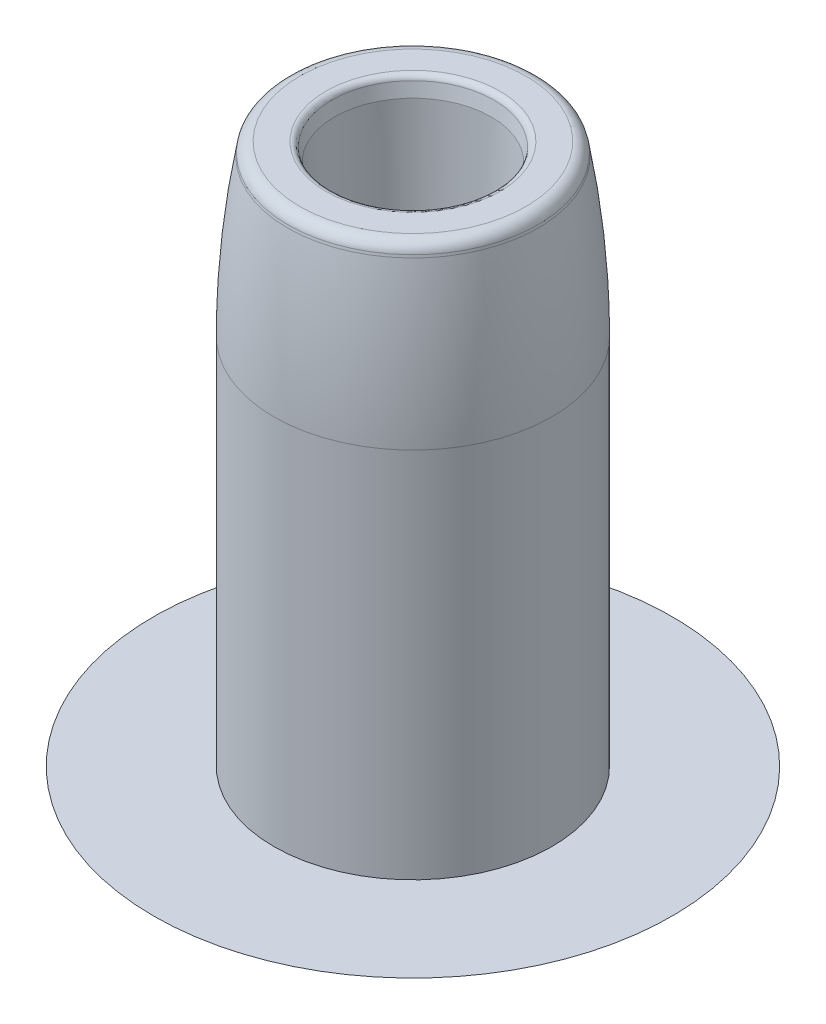
from build123d import *

# Parameters (mm, degrees)
CHAMFER1_SIZE      = 3.81
CHAMFER1_SIZE2     = 0.671805796
FILLET2_R          = 0.508
FILLET3_R          = 38.1
CHAMFER2_SIZE      = 0.762
CHAMFER2_SIZE2     = 0.135060614
FILLET4_R          = 0.254
SKETCH6_R          = 2.950428165
CUT_EXTRUDE1_DEPTH = 28.612445783
FILLET5_R          = 2.54


with BuildPart() as part:
    # Sketch3 → Revolve1 (revolve)
    with BuildSketch(Plane(origin=(0, 0, 0), x_dir=(0, 0, -1), z_dir=(1, 0, 0))):
        with BuildLine():
            Line((-3.331428165, 0.1905), (-2.950428165, -13.7795))
            Line((-2.950428165, -13.7795), (-2.950428165, -22.6695))
            Line((-2.950428165, -22.6695), (0, -22.6695))
            Line((0, -22.6695), (0, -24.1935))
            add(Edge.make_bspline(
                [(-10.951428165, -22.6695), (-7.67361224, -23.87858079), (-8.424695912, -25.057739032), (-3.760861411, -24.039674634), (-1.096246091, -24.1935), (0, -24.1935)],
                knots=[0, 0, 0, 0, 0.345230168, 0.440287605, 1, 1, 1, 1], degree=3))
            Line((-10.951428165, -22.6695), (-5.871428165, -22.6695))
            Line((-5.871428165, -22.6695), (-5.871428165, 0.1905))
            Line((-5.871428165, 0.1905), (-3.331428165, 0.1905))
        make_face()
    revolve(axis=Axis((0, -22.6695, 0), (0, -1, 0)))

    # Chamfer1
    chamfer1_edges = [part.edges().sort_by_distance(p)[0] for p in [
        (0, 0.1905, -5.871428165),
    ]]
    chamfer1_side = [part.faces().sort_by_distance(p)[0] for p in [
        (0, -11.2395, -5.871428165),
    ]]
    chamfer(chamfer1_edges, length=CHAMFER1_SIZE, length2=CHAMFER1_SIZE2, reference=chamfer1_side[0])

    # Fillet2
    fillet2_edges = [part.edges().sort_by_distance(p)[0] for p in [
        (0, 0.1905, -5.199622369),
    ]]
    fillet(fillet2_edges, radius=FILLET2_R)

    # Fillet3
    fillet3_edges = [part.edges().sort_by_distance(p)[0] for p in [
        (0, -3.6195, -5.871428165),
    ]]
    fillet(fillet3_edges, radius=FILLET3_R)

    # Chamfer2
    chamfer2_edges = [part.edges().sort_by_distance(p)[0] for p in [
        (0, 0.1905, -3.331428165),
    ]]
    chamfer2_side = [part.faces().sort_by_distance(p)[0] for p in [
        (0, -6.7945, -3.140928165),
    ]]
    chamfer(chamfer2_edges, length=CHAMFER2_SIZE, length2=CHAMFER2_SIZE2, reference=chamfer2_side[0])

    # Fillet4
    fillet4_edges = [part.edges().sort_by_distance(p)[0] for p in [
        (0, 0.1905, -3.46648878),
    ]]
    fillet(fillet4_edges, radius=FILLET4_R)

    # Sketch6 → Cut-Extrude1 (cut, through all)
    with BuildSketch(Plane(origin=(0, -22.6695, 0), x_dir=(1, 0, 0), z_dir=(0, 1, 0))):
        with Locations(Location((0, 0, 0), (0, 0, 270))):
            Circle(SKETCH6_R)
    extrude(amount=-CUT_EXTRUDE1_DEPTH, mode=Mode.SUBTRACT)

    # Fillet5
    fillet5_edges = [part.edges().sort_by_distance(p)[0] for p in [
        (2e-09, -24.204539733, -2.950428166),
    ]]
    fillet(fillet5_edges, radius=FILLET5_R)


solid = part.part
